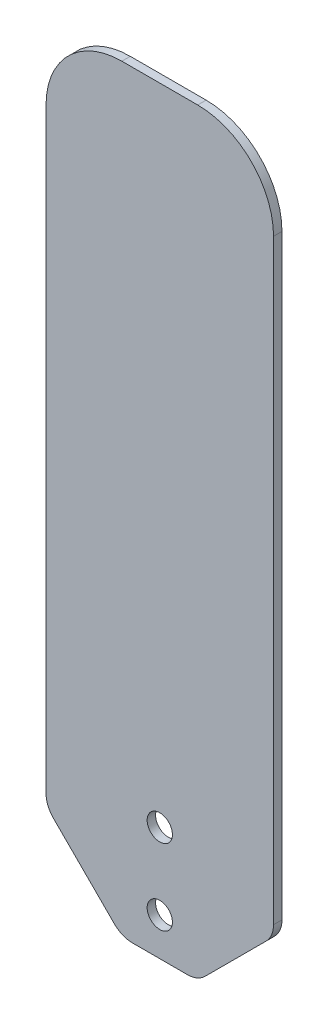
from build123d import *

# Parameters (mm, degrees)
MODEL_R                 = 1.5
SALIENTE_EXTRUIR1_DEPTH = 1


with BuildPart() as part:
    # Model → Saliente-Extruir1 (new body)
    with BuildSketch(Plane.XY):
        with BuildLine():
            Line((95.892530772, 168.7618816), (102.407249398, 168.7618816))
            ThreePointArc((102.407249398, 168.7618816), (103.555299695, 168.990243002), (104.528569741, 169.640561256))
            Line((104.528569741, 169.640561256), (111.771210428, 176.883201943))
            ThreePointArc((111.771210428, 176.883201943), (112.421528682, 177.85647199), (112.649890085, 179.004522287))
            Line((112.649890085, 179.004522287), (112.649890085, 249.7618816))
            ThreePointArc((112.649890085, 249.7618816), (110.013851116, 256.12584263), (103.649890085, 258.7618816))
            Line((103.649890085, 258.7618816), (94.649890085, 258.7618816))
            ThreePointArc((94.649890085, 258.7618816), (88.285929054, 256.12584263), (85.649890085, 249.7618816))
            Line((85.649890085, 249.7618816), (85.649890085, 179.004522287))
            ThreePointArc((85.649890085, 179.004522287), (85.878251487, 177.85647199), (86.528569741, 176.883201943))
            Line((86.528569741, 176.883201943), (93.771210429, 169.640561256))
            ThreePointArc((93.771210429, 169.640561256), (94.744480475, 168.990243002), (95.892530772, 168.7618816))
        make_face()
        with Locations((99.149890085, 173.2618816)):
            Circle(MODEL_R, mode=Mode.SUBTRACT)
        with Locations((99.149890085, 182.2618816)):
            Circle(MODEL_R, mode=Mode.SUBTRACT)
    extrude(amount=SALIENTE_EXTRUIR1_DEPTH)


solid = part.part
